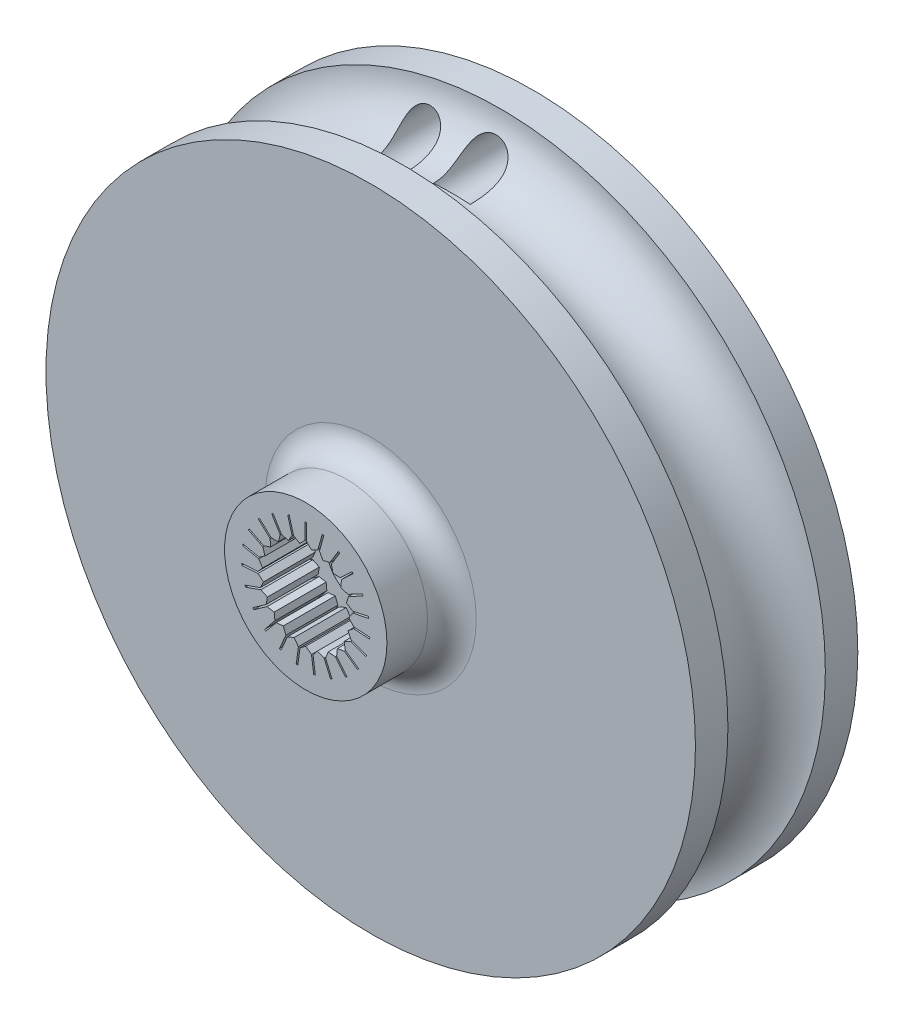
from build123d import *

# Parameters (mm, degrees)
SKETCH_6_R          = 5
EXTRUDE_3_DEPTH     = 4
CUT_EXTRUDE_START   = 4
CUT_EXTRUDE_5_DEPTH = 3.2
FILLET_2_R          = 1.5
SKETCH_9_R          = 1.9
CUT_EXTRUDE_6_DEPTH = 32.559467676
SKETCH_10_R         = 3
CUT_EXTRUDE_7_DEPTH = 5.8
SKETCH_11_R         = 1.25
CUT_EXTRUDE_8_DEPTH = 5


with BuildPart() as part:
    # ｽｹｯﾁ8 → 回転1 (revolve)
    with BuildSketch(Plane(origin=(0, 0, 0), x_dir=(1, 0, 0), z_dir=(0, 1, 0))):
        with BuildLine():
            Line((0, 0), (0, 10))
            Line((0, 10), (20, 10))
            Line((20, 10), (20, 8))
            ThreePointArc((20, 8), (17, 5), (20, 2))
            Line((20, 2), (20, 0))
            Line((20, 0), (0, 0))
        make_face()
    revolve(axis=Axis((0, 0, 0), (0, 0, -1)))

    # ｽｹｯﾁ6 → ﾎﾞｽ - 押し出し3 (add)
    with BuildSketch(Plane.XY):
        Circle(SKETCH_6_R)
    extrude(amount=EXTRUDE_3_DEPTH)

    # ｽｹｯﾁ5 → ｶｯﾄ - 押し出し5 (cut)
    with BuildSketch(Plane.XY.offset(CUT_EXTRUDE_START)):
        Polygon((-0.05, 2.95), (-0.05, 3.95), (0.05, 3.95), (0.05, 2.95), (0.362514094, 2.637485906), (0.747754611, 2.854095836), (1.017551382, 3.817013124), (1.11384311, 3.790033446), (0.844046339, 2.827116159), (1.060656269, 2.441875642), (1.490051682, 2.546516441), (2.009635632, 3.400935845), (2.095077573, 3.34897745), (1.575493623, 2.494558046), (1.680134421, 2.065162633), (2.121838437, 2.050073571), (2.852674402, 2.732626714), (2.920929716, 2.659543117), (2.190093752, 1.976989974), (2.17500469, 1.535285958), (2.596258142, 1.401586122), (3.484143361, 1.86165116), (3.530149865, 1.772862638), (2.642264646, 1.3127976), (2.50856481, 0.891544148), (2.878125258, 0.649149443), (3.857209346, 0.852605456), (3.877554947, 0.754697047), (2.898470859, 0.551241034), (2.656076155, 0.181680586), (2.94653499, -0.151431681), (3.944203759, -0.219674094), (3.937379518, -0.319440971), (2.939710748, -0.251198558), (2.606598481, -0.541657393), (2.796413701, -0.94078181), (3.738674623, -1.275661422), (3.705186662, -1.369887514), (2.76292574, -1.035007902), (2.363801323, -1.224823122), (2.4388952, -1.660358456), (3.255865093, -2.237038778), (3.198197061, -2.318735767), (2.381227168, -1.742055445), (1.945691834, -1.817149322), (1.900495, -2.25679391), (2.531582945, -3.032505201), (2.454011816, -3.095613995), (1.822923871, -2.319902705), (1.383279283, -2.274705871), (1.22114378, -2.685853285), (1.61954487, -3.603064586), (1.52782374, -3.642904695), (1.12942265, -2.725693394), (0.718275236, -2.563557891), (0.451225912, -2.915715208), (0.587392561, -3.906401154), (0.488323967, -3.920017819), (0.352157318, -2.929331873), (0, -2.66228255), (-0.352157318, -2.929331873), (-0.488323967, -3.920017819), (-0.587392561, -3.906401154), (-0.451225912, -2.915715208), (-0.718275236, -2.563557891), (-1.12942265, -2.725693394), (-1.52782374, -3.642904695), (-1.61954487, -3.603064586), (-1.22114378, -2.685853285), (-1.383279283, -2.274705871), (-1.822923871, -2.319902705), (-2.454011816, -3.095613995), (-2.531582945, -3.032505201), (-1.900495, -2.25679391), (-1.945691834, -1.817149322), (-2.381227168, -1.742055445), (-3.198197061, -2.318735767), (-3.255865093, -2.237038778), (-2.4388952, -1.660358456), (-2.363801323, -1.224823122), (-2.76292574, -1.035007902), (-3.705186662, -1.369887514), (-3.738674623, -1.275661422), (-2.796413701, -0.94078181), (-2.606598481, -0.541657393), (-2.939710748, -0.251198558), (-3.937379518, -0.319440971), (-3.944203759, -0.219674094), (-2.94653499, -0.151431681), (-2.656076155, 0.181680586), (-2.898470859, 0.551241034), (-3.877554947, 0.754697047), (-3.857209346, 0.852605456), (-2.878125258, 0.649149443), (-2.50856481, 0.891544148), (-2.642264646, 1.3127976), (-3.530149865, 1.772862638), (-3.484143361, 1.86165116), (-2.596258142, 1.401586122), (-2.17500469, 1.535285958), (-2.190093752, 1.976989974), (-2.920929716, 2.659543117), (-2.852674402, 2.732626714), (-2.121838437, 2.050073571), (-1.680134421, 2.065162633), (-1.575493623, 2.494558046), (-2.095077573, 3.34897745), (-2.009635632, 3.400935845), (-1.490051682, 2.546516441), (-1.060656269, 2.441875642), (-0.844046339, 2.827116159), (-1.11384311, 3.790033446), (-1.017551382, 3.817013124), (-0.747754611, 2.854095836), (-0.362514094, 2.637485906), align=None)
    extrude(amount=-CUT_EXTRUDE_5_DEPTH, mode=Mode.SUBTRACT)

    # ﾌｨﾚｯﾄ2
    fillet_2_edges = [part.edges().sort_by_distance(p)[0] for p in [
        (-5, 0, 0),
    ]]
    fillet(fillet_2_edges, radius=FILLET_2_R)

    # ｽｹｯﾁ9 → ｶｯﾄ - 押し出し6 (cut, through all)
    with BuildSketch(Plane(origin=(0, 0, -10), x_dir=(-1, 0, 0), z_dir=(0, 0, -1))):
        Circle(SKETCH_9_R)
    extrude(amount=-CUT_EXTRUDE_6_DEPTH, mode=Mode.SUBTRACT)

    # ｽｹｯﾁ10 → ｶｯﾄ - 押し出し7 (cut)
    with BuildSketch(Plane(origin=(0, 0, -10), x_dir=(-1, 0, 0), z_dir=(0, 0, -1))):
        Circle(SKETCH_10_R)
    extrude(amount=-CUT_EXTRUDE_7_DEPTH, mode=Mode.SUBTRACT)

    # ｽｹｯﾁ11 → ｶｯﾄ - 押し出し8 (cut)
    with BuildSketch(Plane.XY.offset(-10)):
        with Locations(Location((0, 17.5, 0), (0, 0, 205.467560142))):
            Circle(SKETCH_11_R)
        with Locations(Location((-3.973791692, 17.042857143, 0), (0, 0, 218.59241588))):
            Circle(SKETCH_11_R)
    extrude(amount=CUT_EXTRUDE_8_DEPTH, mode=Mode.SUBTRACT)


solid = part.part
